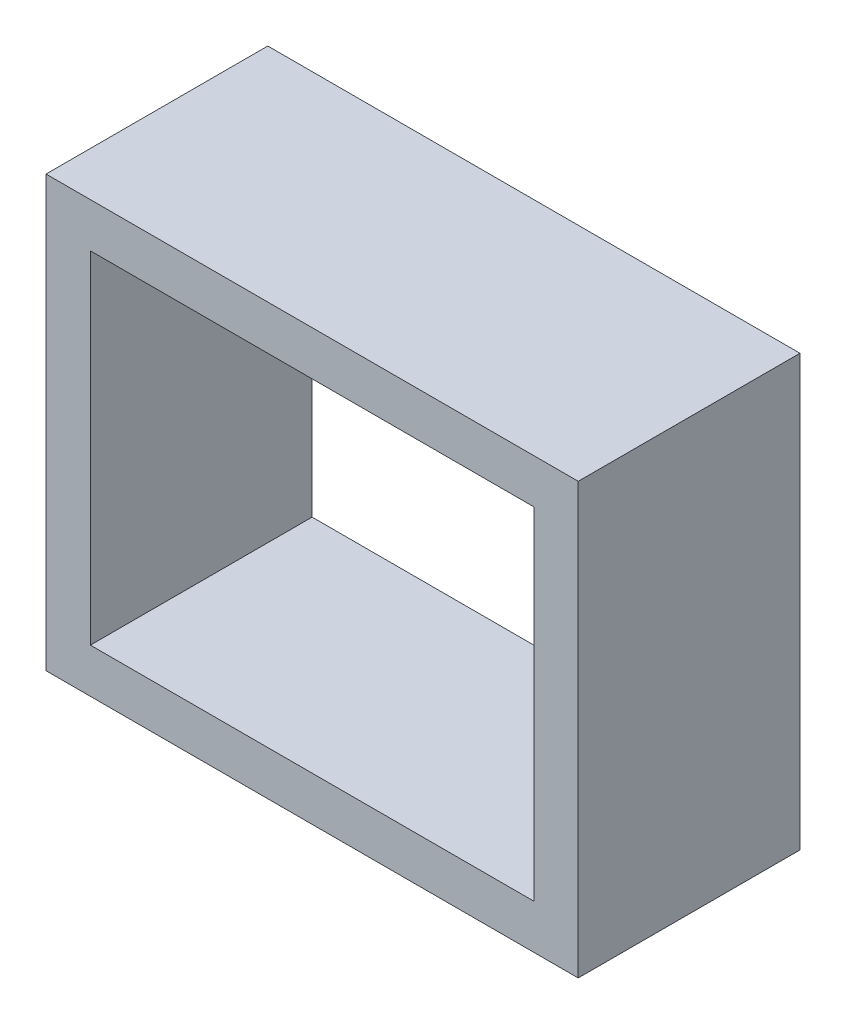
from build123d import *

# Parameters (mm, degrees)
SKETCH1_W           = 120
SKETCH1_H           = 97
SKETCH1_W_2         = 100
SKETCH1_H_2         = 77
EXTRUDE_THIN1_DEPTH = 50


with BuildPart() as part:
    # Sketch1 → Extrude-Thin1 (new body)
    with BuildSketch(Plane.XY):
        with Locations((0, -1.833333333)):
            Rectangle(SKETCH1_W, SKETCH1_H)
        with Locations((0, -1.833333333)):
            Rectangle(SKETCH1_W_2, SKETCH1_H_2, mode=Mode.SUBTRACT)
    extrude(amount=EXTRUDE_THIN1_DEPTH)


solid = part.part
